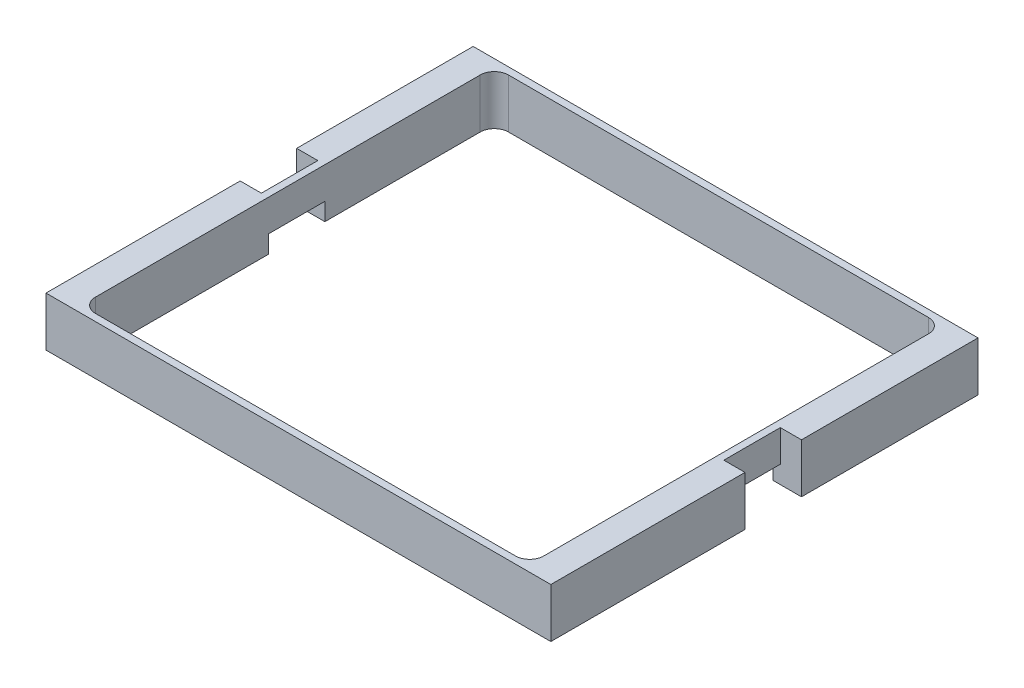
from build123d import *

# Parameters (mm, degrees)
SKETCH_1_W          = 71.5
SKETCH_1_H          = 60.5
SKETCH_1_W_2        = 63.5
SKETCH_1_H_2        = 58.5
EXTRUDE_1_DEPTH     = 7
FILLET_1_R          = 2
SKETCH_2_W          = 3
SKETCH_2_H          = 8
CUT_EXTRUDE_1_DEPTH = 7
SKETCH_3_W          = 8
SKETCH_3_H          = 2.5
CUT_EXTRUDE_2_DEPTH = 92.002747211


with BuildPart() as part:
    # Эскиз1 → Бобышка-Вытянуть1 (new body)
    with BuildSketch(Plane(origin=(0, 0, 0), x_dir=(1, 0, 0), z_dir=(0, 1, 0))):
        with Locations((31.75, -29.25)):
            Rectangle(SKETCH_1_W, SKETCH_1_H)
        with Locations((31.75, -29.25)):
            Rectangle(SKETCH_1_W_2, SKETCH_1_H_2, mode=Mode.SUBTRACT)
    extrude(amount=EXTRUDE_1_DEPTH)

    # Скругление1
    fillet_1_edges = [part.edges().sort_by_distance(p)[0] for p in [
        (0, 3.5, 0),
        (0, 3.5, 58.5),
        (63.5, 3.5, 58.5),
        (63.5, 3.5, 0),
    ]]
    fillet(fillet_1_edges, radius=FILLET_1_R)

    # Эскиз2 → Вырез-Вытянуть1 (cut)
    with BuildSketch(Plane(origin=(0, 7, 0), x_dir=(1, 0, 0), z_dir=(0, 1, 0))):
        with Locations((-2.5, -28)):
            Rectangle(SKETCH_2_W, SKETCH_2_H)
        with Locations((66, -28)):
            Rectangle(SKETCH_2_W, SKETCH_2_H)
    extrude(amount=-CUT_EXTRUDE_1_DEPTH, mode=Mode.SUBTRACT)

    # Эскиз3 → Вырез-Вытянуть2 (cut, through all)
    with BuildSketch(Plane(origin=(64.5, 0, 0), x_dir=(0, 0, -1), z_dir=(1, 0, 0))):
        with Locations((-28, 1.25)):
            Rectangle(SKETCH_3_W, SKETCH_3_H)
    extrude(amount=-CUT_EXTRUDE_2_DEPTH, mode=Mode.SUBTRACT)


solid = part.part
